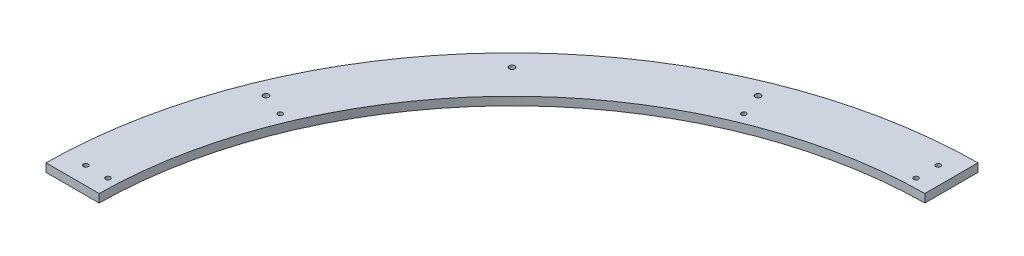
from build123d import *

# Parameters (mm, degrees)
BOSS_EXTRUDE1_DEPTH            = 11.90625
SKETCH2_W                      = 12.7
SKETCH2_H                      = 38.133687951
SKETCH2_W_2                    = 38.133687951
SKETCH2_H_2                    = 12.7
CUT_EXTRUDE1_DEPTH             = 955.226495179
F_1_4_CLEARANCE_HOLE2_D        = 6.7564
SKETCH8_W                      = 674.6875
SKETCH8_H                      = 674.6875
CUT_EXTRUDE4_DEPTH             = 955.226495179
F_5_16_0_3125_DIAMETER_HOLE1_D = 7.9375
SKETCH14_W                     = 6.35
SKETCH14_H                     = 76.233687951
SKETCH14_W_2                   = 76.233687951
SKETCH14_H_2                   = 6.35
CUT_EXTRUDE7_DEPTH             = 955.226495179


with BuildPart() as part:
    # Sketch1 → Boss-Extrude1 (new body)
    with BuildSketch(Plane(origin=(0, 0, 0), x_dir=(1, 0, 0), z_dir=(0, 1, 0))):
        with BuildLine():
            Line((-598.4875, 0), (-674.6875, 0))
            ThreePointArc((-674.6875, 0), (0, 674.6875), (674.6875, 0))
            Line((674.6875, 0), (598.4875, 0))
            ThreePointArc((598.4875, 0), (0, 598.4875), (-598.4875, 0))
        make_face()
    extrude(amount=BOSS_EXTRUDE1_DEPTH)

    # Sketch2 → Cut-Extrude1 (cut, through all)
    with BuildSketch(Plane(origin=(0, 11.90625, 0), x_dir=(1, 0, 0), z_dir=(0, 1, 0))):
        with Locations((0, 617.520656025)):
            Rectangle(SKETCH2_W, SKETCH2_H)
        with Locations((617.520656025, 0)):
            Rectangle(SKETCH2_W_2, SKETCH2_H_2)
        with Locations((0, -617.520656025)):
            Rectangle(SKETCH2_W, SKETCH2_H)
        with Locations((-617.520656025, 0)):
            Rectangle(SKETCH2_W_2, SKETCH2_H_2)
    extrude(amount=-CUT_EXTRUDE1_DEPTH, mode=Mode.SUBTRACT)

    # 1/4 Clearance Hole2 (through all)
    with Locations(Plane(origin=(0, 11.90625, 0), x_dir=(1, 0, 0), z_dir=(0, 1, 0))):
        with Locations((-31.75, 642.9375), (-31.75, 611.1875), (-611.1875, 31.75), (-642.9375, 31.75), (-567.596939292, 235.106350216), (-235.106350216, 567.596939292)):
            Hole(F_1_4_CLEARANCE_HOLE2_D / 2)

    # Sketch8 → Cut-Extrude4 (cut, through all)
    with BuildSketch(Plane(origin=(0, 11.90625, 0), x_dir=(1, 0, 0), z_dir=(0, 1, 0))):
        with Locations((337.34375, 337.34375)):
            Rectangle(SKETCH8_W, SKETCH8_H)
    extrude(amount=-CUT_EXTRUDE4_DEPTH, mode=Mode.SUBTRACT)

    # 5/16 (0.3125) Diameter Hole1 (through all)
    with Locations(Plane(origin=(0, 11.90625, 0), x_dir=(1, 0, 0), z_dir=(0, 1, 0))):
        with Locations((-247.471182654, 600.276828982), (-459.11559419, 459.11559419), (-600.276828982, 247.471182654)):
            Hole(F_5_16_0_3125_DIAMETER_HOLE1_D / 2)

    # Sketch14 → Cut-Extrude7 (cut, through all)
    with BuildSketch(Plane(origin=(0, 11.90625, 0), x_dir=(1, 0, 0), z_dir=(0, 1, 0))):
        with Locations((-3.175, 636.570656025)):
            Rectangle(SKETCH14_W, SKETCH14_H)
        with Locations((-636.570656025, 3.175)):
            Rectangle(SKETCH14_W_2, SKETCH14_H_2)
    extrude(amount=-CUT_EXTRUDE7_DEPTH, mode=Mode.SUBTRACT)


solid = part.part
